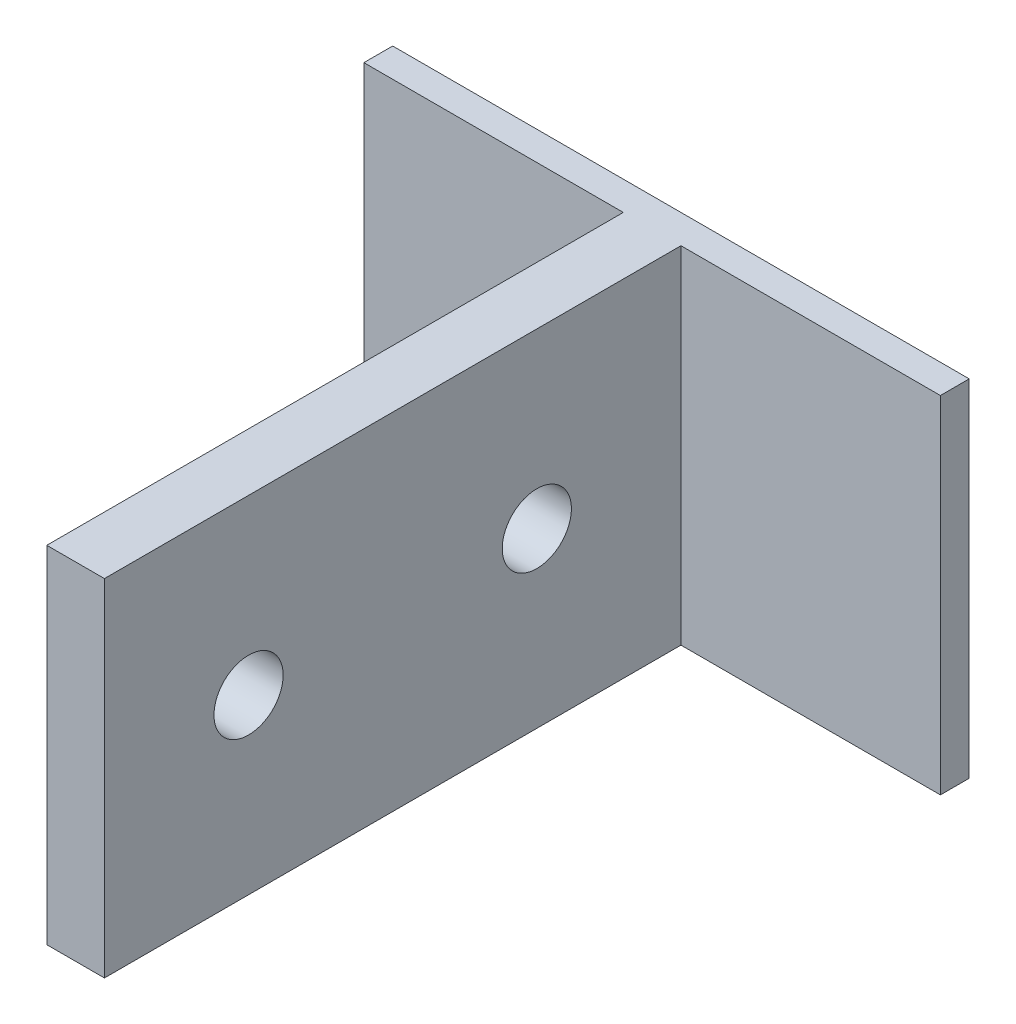
from build123d import *

# Parameters (mm, degrees)
CROQUIS3_W              = 100
CROQUIS3_H              = 60
SALIENTE_EXTRUIR1_DEPTH = 5
CROQUIS3_3_W            = 10
CROQUIS3_3_H            = 60
SALIENTE_EXTRUIR2_DEPTH = 100
CROQUIS5_R              = 6
CORTAR_EXTRUIR1_DEPTH   = 20


with BuildPart() as part:
    # Croquis3 → Saliente-Extruir1 (new body)
    with BuildSketch(Plane.XY):
        Rectangle(CROQUIS3_W, CROQUIS3_H)
    extrude(amount=-SALIENTE_EXTRUIR1_DEPTH)

    # Croquis3<3> → Saliente-Extruir2 (add)
    with BuildSketch(Plane.XY):
        Rectangle(CROQUIS3_3_W, CROQUIS3_3_H)
    extrude(amount=SALIENTE_EXTRUIR2_DEPTH)

    # Croquis5 → Cortar-Extruir1 (cut)
    with BuildSketch(Plane(origin=(5, 0, 0), x_dir=(0, 0, -1), z_dir=(1, 0, 0))):
        with Locations((-75, 0)):
            Circle(CROQUIS5_R)
        with Locations((-25, 0)):
            Circle(CROQUIS5_R)
    extrude(amount=-CORTAR_EXTRUIR1_DEPTH, mode=Mode.SUBTRACT)


solid = part.part
